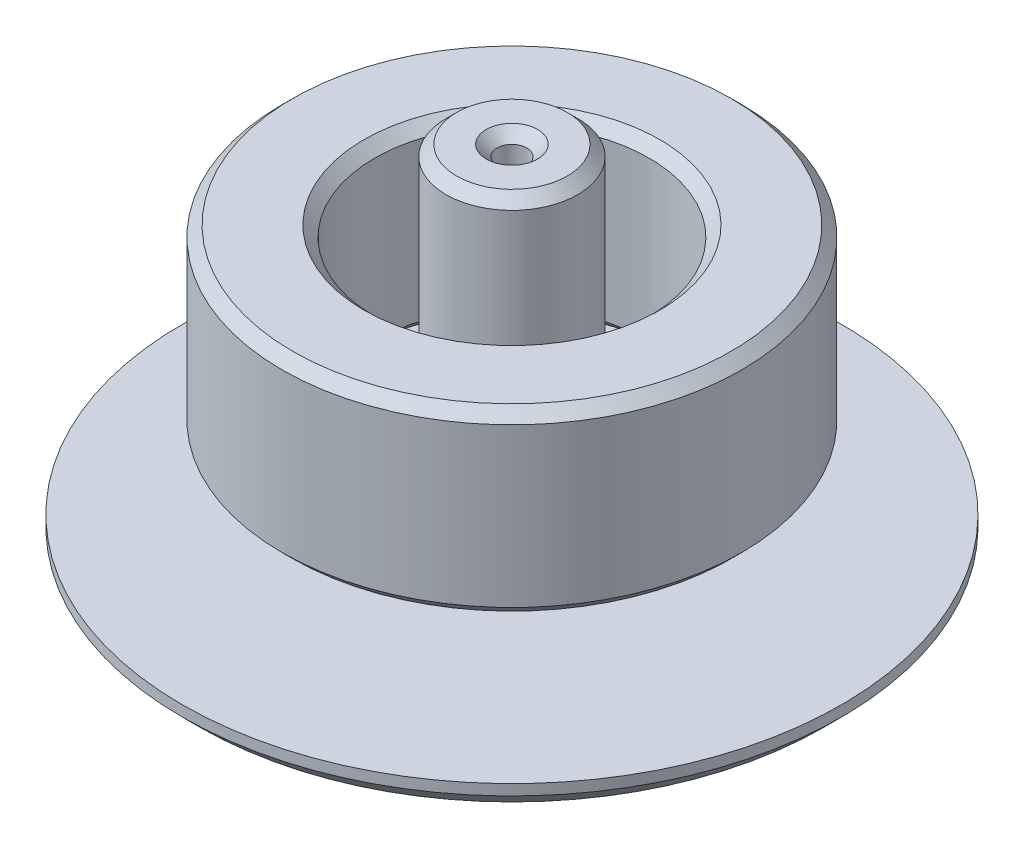
from build123d import *


with BuildPart() as part:
    # Sketch2 → Revolve1 (revolve)
    with BuildSketch(Plane(origin=(0, 0, 0), x_dir=(0, 0, -1), z_dir=(1, 0, 0))):
        Polygon((-32.25, 11.1), (-30.75, 12.6), (-20.75, 12.6), (-19.25, 11.1), (-19.25, -11.1), (-20.75, -12.6), (-30.75, -12.6), (-32.25, -11.1), align=None)
        Polygon((-39.75, -22.6), (-11.75, -22.6), (-9.25, -20.1), (-9.25, 20.9), (-7.75, 22.4), (-3.6, 22.4), (-2.1, 20.9), (-2.1, -24.1), (-4.6, -26.6), (-43.75, -26.6), (-46.25, -24.1), (-46.25, -22.6), align=None)
    revolve(axis=Axis((0, 44.566477302, 0), (0, -1, 0)))


solid = part.part
